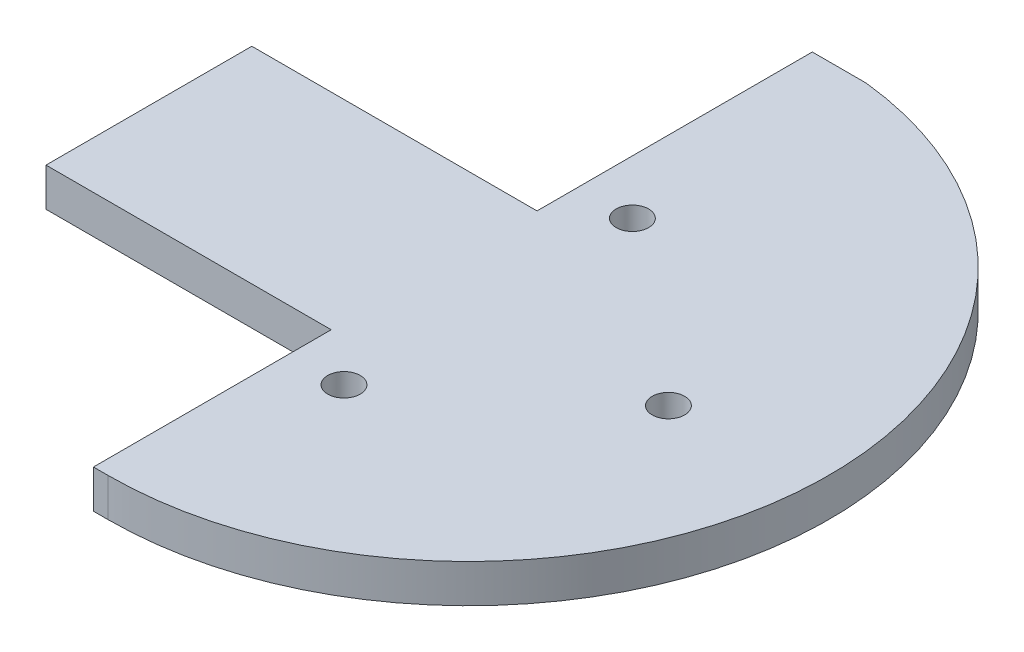
from build123d import *

# Parameters (mm, degrees)
SKETCH1_R           = 1.143
BOSS_EXTRUDE1_DEPTH = 2.7


with BuildPart() as part:
    # Sketch1 → Boss-Extrude1 (new body)
    with BuildSketch(Plane(origin=(0, 0, 0), x_dir=(1, 0, 0), z_dir=(0, 1, 0))):
        with BuildLine():
            Line((-11.327327395, -33.908852397), (-11.327327395, -50.658852397))
            Line((-11.327327395, -50.658852397), (-10.311327339, -50.658852397))
            ThreePointArc((-10.311327339, -50.658852397), (15.050108966, -26.657976598), (-7.517327395, -0.012990077))
            Line((-7.517327395, -0.012990077), (-11.327327395, -0.012990077))
            Line((-11.327327395, -0.012990077), (-11.327327395, -19.407100798))
            Line((-11.327327395, -19.407100798), (-31.421327339, -19.407100798))
            Line((-31.421327339, -19.407100798), (-31.421327339, -33.908852397))
            Line((-31.421327339, -33.908852397), (-11.327327395, -33.908852397))
        make_face()
        with Locations(Location((-7.517327395, -16.497976598, 0), (0, 0, 90))):
            Circle(SKETCH1_R, mode=Mode.SUBTRACT)
        with Locations(Location((-7.517327395, -36.817976598, 0), (0, 0, 90))):
            Circle(SKETCH1_R, mode=Mode.SUBTRACT)
        with Locations(Location((5.182672605, -26.657976598, 0), (0, 0, 90))):
            Circle(SKETCH1_R, mode=Mode.SUBTRACT)
    extrude(amount=BOSS_EXTRUDE1_DEPTH)


solid = part.part
